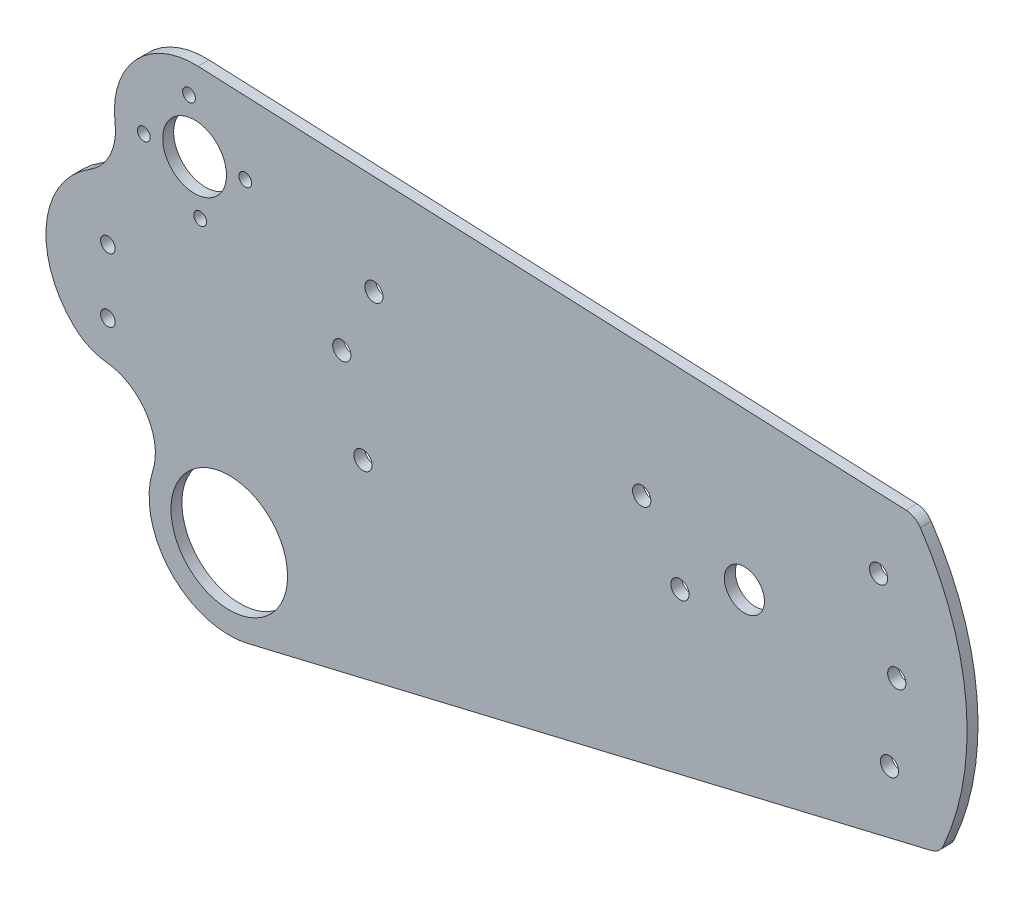
from build123d import *

# Parameters (mm, degrees)
SKETCH1_R           = 2
SKETCH1_R_2         = 2.5
SKETCH1_R_3         = 5.5
SKETCH1_R_4         = 1.75
SKETCH1_R_5         = 8.75
SKETCH1_R_6         = 16
BOSS_EXTRUDE1_DEPTH = 3


with BuildPart() as part:
    # Sketch1 → Boss-Extrude1 (new body)
    with BuildSketch(Plane.XY):
        with BuildLine():
            ThreePointArc((-113.560266524, 49.479735972), (-130.694234864, 42.395842918), (-136.329525131, 24.732380193))
            ThreePointArc((-136.329525131, 24.732380193), (-137.686520221, 16.356467092), (-143.370984404, 10.056925608))
            ThreePointArc((-143.370984404, 10.056925608), (-155.166532009, -8.626129333), (-147.542861296, -29.364285714))
            ThreePointArc((-147.542861296, -29.364285714), (-143.475887893, -32.124161339), (-138.735140925, -33.421275181))
            ThreePointArc((-138.735140925, -33.421275181), (-127.733357788, -40.106373668), (-125.965715234, -52.858048609))
            ThreePointArc((-125.965715234, -52.858048609), (-121.095745986, -74.463536322), (-99.899442585, -80.88462828))
            Line((-99.899442585, -80.88462828), (87.590338172, -36.326384859))
            ThreePointArc((87.590338172, -36.326384859), (89.625170423, -35.311295666), (91, -33.5))
            ThreePointArc((91, -33.5), (97.213976906, 3.543991621), (84.648444567, 38.941424032))
            ThreePointArc((84.648444567, 38.941424032), (82.945648013, 40.504860181), (80.721588123, 41.135261877))
            Line((80.721588123, 41.135261877), (-113.560266524, 49.479735972))
        make_face()
        with Locations((-138.3, -22.75)):
            Circle(SKETCH1_R, mode=Mode.SUBTRACT)
        with Locations((-68.3, -21.5)):
            Circle(SKETCH1_R_2, mode=Mode.SUBTRACT)
        with Locations((-138.3, -5.25)):
            Circle(SKETCH1_R, mode=Mode.SUBTRACT)
        with Locations((-74.1, 1.7)):
            Circle(SKETCH1_R_2, mode=Mode.SUBTRACT)
        with Locations((18.7, -8.7)):
            Circle(SKETCH1_R_2, mode=Mode.SUBTRACT)
        with Locations((76.2, -22)):
            Circle(SKETCH1_R_2, mode=Mode.SUBTRACT)
        with Locations((8.2, 8.3)):
            Circle(SKETCH1_R_2, mode=Mode.SUBTRACT)
        with Locations((36.382449965, 0)):
            Circle(SKETCH1_R_3, mode=Mode.SUBTRACT)
        with Locations((78.2, -0.1)):
            Circle(SKETCH1_R_2, mode=Mode.SUBTRACT)
        with Locations((-112.981409671, 13.583075301)):
            Circle(SKETCH1_R_4, mode=Mode.SUBTRACT)
        with Locations((-128.421228626, 25.977105744)):
            Circle(SKETCH1_R_4, mode=Mode.SUBTRACT)
        with Locations((-65.3, 20)):
            Circle(SKETCH1_R_2, mode=Mode.SUBTRACT)
        with Locations((-114.504303927, 27.5)):
            Circle(SKETCH1_R_5, mode=Mode.SUBTRACT)
        with Locations((-100.587379227, 29.022894256)):
            Circle(SKETCH1_R_4, mode=Mode.SUBTRACT)
        with Locations((-116.027198182, 41.416924699)):
            Circle(SKETCH1_R_4, mode=Mode.SUBTRACT)
        with Locations((73.2, 22.3)):
            Circle(SKETCH1_R_2, mode=Mode.SUBTRACT)
        with Locations((-104.986214828, -59.480779371)):
            Circle(SKETCH1_R_6, mode=Mode.SUBTRACT)
    extrude(amount=BOSS_EXTRUDE1_DEPTH)


solid = part.part
